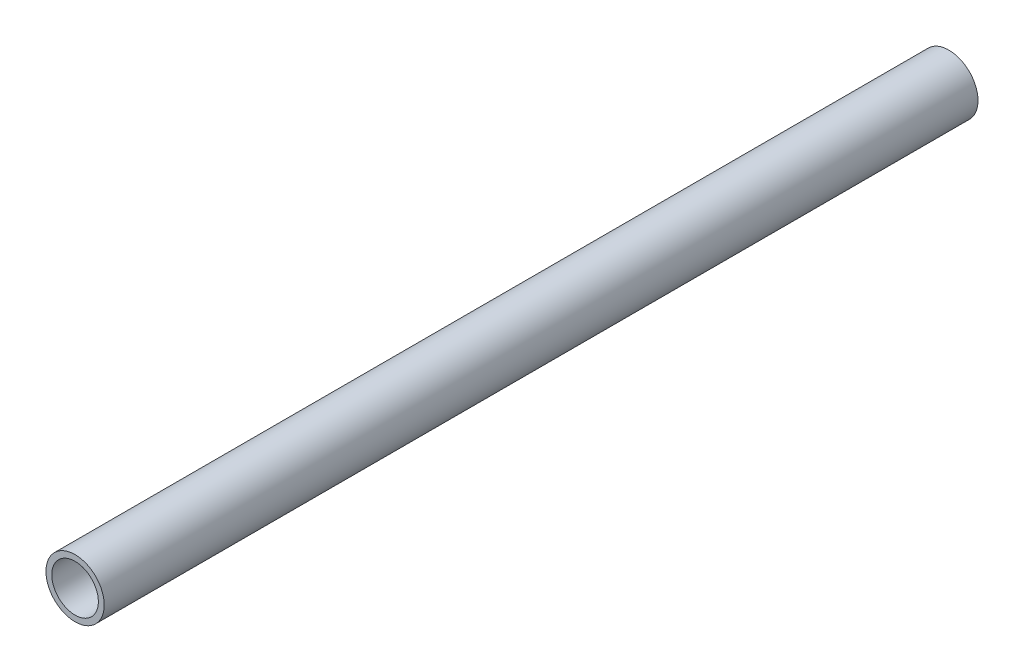
from build123d import *

# Parameters (mm, degrees)
SZKIC1_R                    = 10
SZKIC1_R_2                  = 8
DODANIE_WYCI_GNI_CIE1_DEPTH = 300


with BuildPart() as part:
    # Szkic1 → Dodanie-wyciągnięcie1 (new body)
    with BuildSketch(Plane.XY):
        Circle(SZKIC1_R)
        Circle(SZKIC1_R_2, mode=Mode.SUBTRACT)
    extrude(amount=DODANIE_WYCI_GNI_CIE1_DEPTH)


solid = part.part
